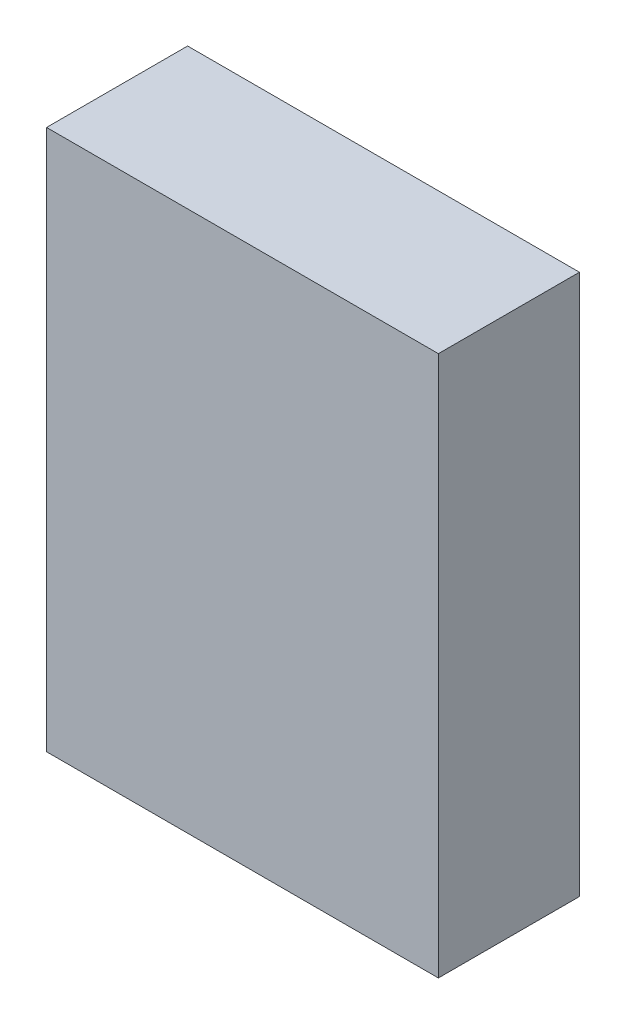
from build123d import *

# Parameters (mm, degrees)
SKETCH1_W           = 50
SKETCH1_H           = 69
BOSS_EXTRUDE1_DEPTH = 18


with BuildPart() as part:
    # Sketch1 → Boss-Extrude1 (new body)
    with BuildSketch(Plane.XY):
        with Locations((25, 34.5)):
            Rectangle(SKETCH1_W, SKETCH1_H)
    extrude(amount=BOSS_EXTRUDE1_DEPTH)


solid = part.part
